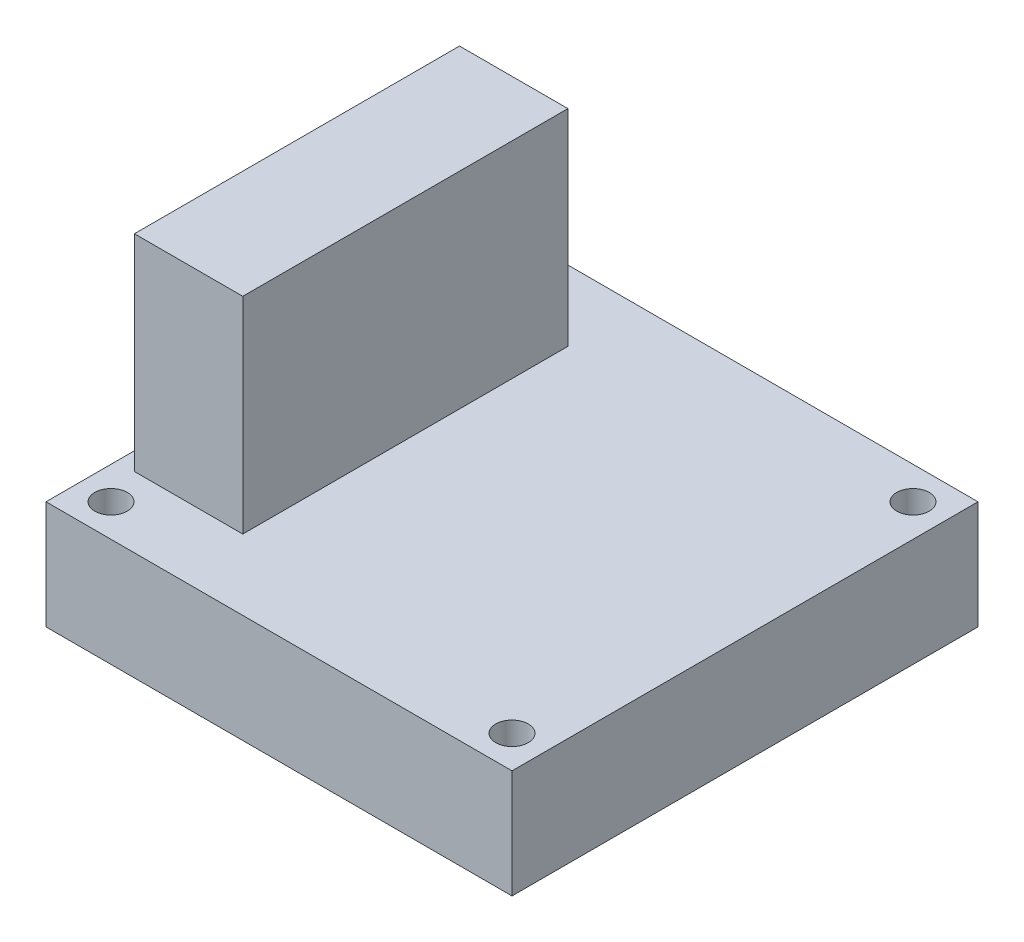
from build123d import *

# Parameters (mm, degrees)
SKETCH_1_W      = 43
SKETCH_1_H      = 43
SKETCH_1_R      = 1.5
EXTRUDE_1_DEPTH = 10
SKETCH_2_W      = 10
SKETCH_2_H      = 30
EXTRUDE_2_DEPTH = 19


with BuildPart() as part:
    # 草圖1 → 填料-伸長1 (new body)
    with BuildSketch(Plane(origin=(0, 0, 0), x_dir=(1, 0, 0), z_dir=(0, 1, 0))):
        Rectangle(SKETCH_1_W, SKETCH_1_H)
        with Locations(Location((-18.5, 18.5, 0), (0, 0, 270))):
            Circle(SKETCH_1_R, mode=Mode.SUBTRACT)
        with Locations(Location((18.5, 18.5, 0), (0, 0, 270))):
            Circle(SKETCH_1_R, mode=Mode.SUBTRACT)
        with Locations(Location((18.5, -18.5, 0), (0, 0, 270))):
            Circle(SKETCH_1_R, mode=Mode.SUBTRACT)
        with Locations(Location((-18.5, -18.5, 0), (0, 0, 270))):
            Circle(SKETCH_1_R, mode=Mode.SUBTRACT)
    extrude(amount=EXTRUDE_1_DEPTH)

    # 草圖2 → 填料-伸長2 (add)
    with BuildSketch(Plane(origin=(0, 10, 0), x_dir=(1, 0, 0), z_dir=(0, 1, 0))):
        with Locations((-14.841942401, 0)):
            Rectangle(SKETCH_2_W, SKETCH_2_H)
    extrude(amount=EXTRUDE_2_DEPTH)


solid = part.part
